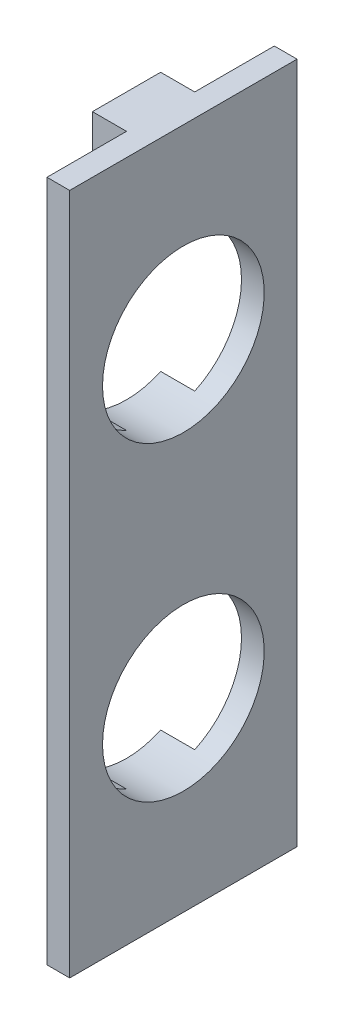
from build123d import *

# Parameters (mm, degrees)
BOSS_EXTRUDE1_DEPTH = 30
SKETCH2_R           = 3.556
CUT_EXTRUDE1_DEPTH  = 30


with BuildPart() as part:
    # Sketch1 → Boss-Extrude1 (new body)
    with BuildSketch(Plane(origin=(0, 0, 0), x_dir=(1, 0, 0), z_dir=(0, 1, 0))):
        Polygon((-1.62605042, 3), (-1.62605042, 6.5), (-0.62605042, 6.5), (-0.62605042, -3.5), (-1.62605042, -3.5), (-1.62605042, 0), (-3.12605042, 0), (-3.12605042, 3), align=None)
    extrude(amount=BOSS_EXTRUDE1_DEPTH)

    # Sketch2 → Cut-Extrude1 (cut)
    with BuildSketch(Plane.ZY.offset(3.12605042)):
        with Locations((-1.5, 21.829992104)):
            Circle(SKETCH2_R)
        with Locations((-1.5, 8.170007896)):
            Circle(SKETCH2_R)
    extrude(amount=-CUT_EXTRUDE1_DEPTH, mode=Mode.SUBTRACT)


solid = part.part
